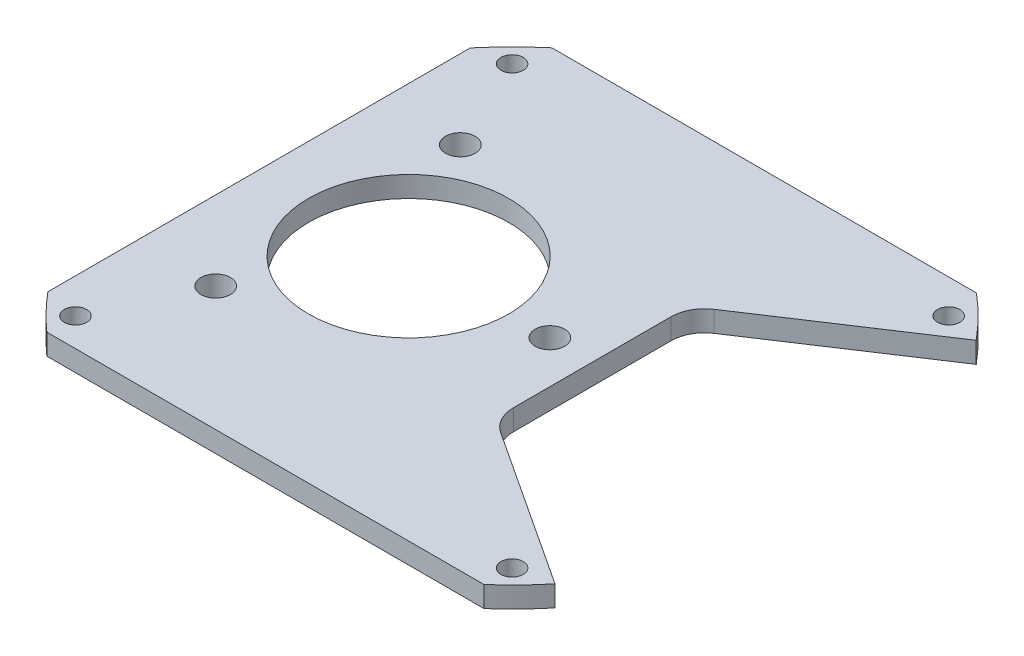
from build123d import *

# Parameters (mm, degrees)
SKETCH1_R            = 15.24
BOSS_EXTRUDE1_DEPTH  = 1.5875
M3_CLEARANCE_HOLE1_D = 3.4
FILLET1_R            = 5.08
M4_CLEARANCE_HOLE2_D = 4.5
CIRPATTERN1_COUNT    = 3


with BuildPart() as part:
    # Sketch1 → Boss-Extrude1 (new, symmetric)
    with BuildSketch(Plane(origin=(0, 0, 0), x_dir=(1, 0, 0), z_dir=(0, 1, 0))):
        with BuildLine():
            Line((-38.50947489, 32.14883464), (-38.50947489, -32.14883464))
            ThreePointArc((-38.50947489, -32.14883464), (-35.992876625, -34.943383598), (-33.274, -37.541552299))
            Line((-33.274, -37.541552299), (33.274, -37.541552299))
            ThreePointArc((33.274, -37.541552299), (36.035191498, -34.899744966), (38.587271968, -32.055415565))
            Line((38.587271968, -32.055415565), (12.205850338, -14.733372241))
            Line((12.205850338, -14.733372241), (12.205850338, 14.733372241))
            Line((12.205850338, 14.733372241), (38.541369471, 32.110591154))
            ThreePointArc((38.541369471, 32.110591154), (35.567819018, 35.375944868), (32.318597457, 38.367114609))
            Line((32.318597457, 38.367114609), (-32.318597457, 38.367114609))
            ThreePointArc((-32.318597457, 38.367114609), (-35.55025611, 35.393594272), (-38.50947489, 32.14883464))
        make_face()
        with Locations((-15.748, 0)):
            Circle(SKETCH1_R, mode=Mode.SUBTRACT)
    extrude(amount=BOSS_EXTRUDE1_DEPTH, both=True)

    # M3 Clearance Hole1 (through all)
    with Locations(Plane(origin=(0, 1.5875, 0), x_dir=(1, 0, 0), z_dir=(0, 1, 0))):
        with Locations((-33.226947648, 33.226947648), (33.226947648, 33.226947648), (33.226947648, -33.226947648), (-33.226947648, -33.226947648)):
            Hole(M3_CLEARANCE_HOLE1_D / 2)

    # Fillet1
    fillet1_edges = [part.edges().sort_by_distance(p)[0] for p in [
        (12.205850338, 0, -14.733372241),
        (12.205850338, 0, 14.733372241),
    ]]
    fillet(fillet1_edges, radius=FILLET1_R)

    # M4 Clearance Hole2 (through all)
    with Locations(Plane(origin=(0, -1.5875, 0), x_dir=(-1, 0, 0), z_dir=(0, -1, 0))):
        with Locations((-5.752, 0)):
            m4_clearance_hole2 = Hole(M4_CLEARANCE_HOLE2_D / 2)

    # CirPattern1: M4 Clearance Hole2 ×3 about axis
    cirpattern1_axis = Axis((-15.748, 0, 0), (0, -1, 0))
    for i in range(1, CIRPATTERN1_COUNT):
        add(m4_clearance_hole2.rotate(cirpattern1_axis, i * 360 / CIRPATTERN1_COUNT), mode=Mode.SUBTRACT)


solid = part.part
